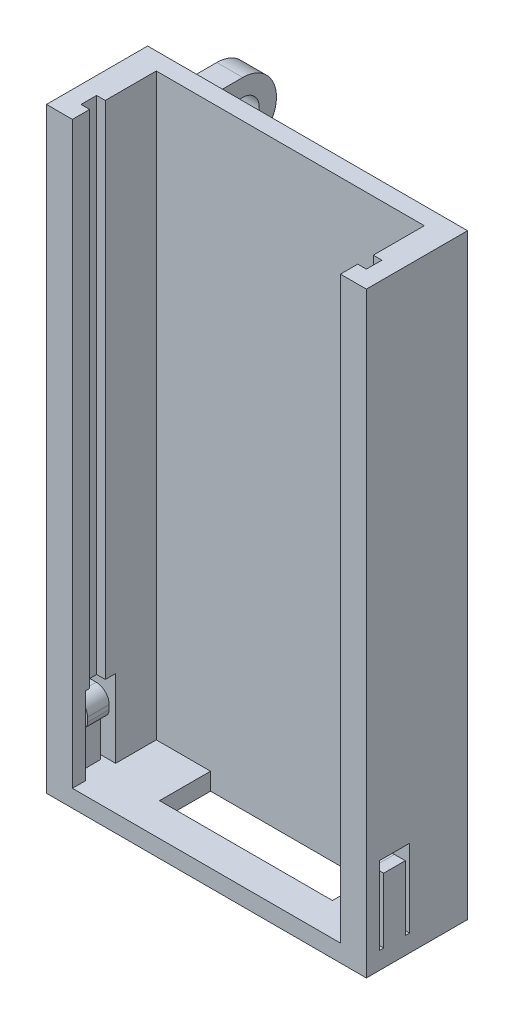
from build123d import *

# Parameters (mm, degrees)
SKETCH1_W           = 37
SKETCH1_H           = 11.7
BOSS_EXTRUDE1_DEPTH = 69
CUT_EXTRUDE1_DEPTH  = 67
SKETCH3_W           = 20
SKETCH3_H           = 5.9
CUT_EXTRUDE2_DEPTH  = 67
BOSS_EXTRUDE2_START = -34
SKETCH4_R           = 1.9
BOSS_EXTRUDE2_DEPTH = 3
FILLET1_R           = 2
SKETCH5_W           = 3.5
SKETCH5_H           = 9
CUT_EXTRUDE3_DEPTH  = 40
BOSS_EXTRUDE3_START = 0.5
BOSS_EXTRUDE3_DEPTH = 2.5


with BuildPart() as part:
    # Sketch1 → Boss-Extrude1 (new body)
    with BuildSketch(Plane(origin=(0, 0, 0), x_dir=(1, 0, 0), z_dir=(0, 1, 0))):
        with Locations((18.5, 5.85)):
            Rectangle(SKETCH1_W, SKETCH1_H)
    extrude(amount=BOSS_EXTRUDE1_DEPTH)

    # Sketch2 → Cut-Extrude1 (cut)
    with BuildSketch(Plane(origin=(0, 69, 0), x_dir=(1, 0, 0), z_dir=(0, 1, 0))):
        Polygon((3, 0), (3, 2), (2, 2), (2, 3.8), (3, 3.8), (3, 9.7), (34, 9.7), (34, 3.8), (35, 3.8), (35, 2), (34, 2), (34, 0), align=None)
    extrude(amount=-CUT_EXTRUDE1_DEPTH, mode=Mode.SUBTRACT)

    # Sketch3 → Cut-Extrude2 (cut)
    with BuildSketch(Plane(origin=(0, 2, 0), x_dir=(1, 0, 0), z_dir=(0, 1, 0))):
        with Locations((19.275, 6.75)):
            Rectangle(SKETCH3_W, SKETCH3_H)
    extrude(amount=-CUT_EXTRUDE2_DEPTH, mode=Mode.SUBTRACT)

    # Sketch4 → Boss-Extrude2 (add)
    # profile 1 of 2: a face of its own
    with BuildSketch(Plane(origin=(37, 0, 0), x_dir=(0, 0, -1), z_dir=(1, 0, 0)).offset(BOSS_EXTRUDE2_START)):
        with BuildLine():
            Line((11.7, 63.35), (19.7, 63.35))
            ThreePointArc((19.7, 63.35), (23.6, 59.45), (19.7, 55.55))
            Line((19.7, 55.55), (11.7, 55.55))
            Line((11.7, 55.55), (11.7, 63.35))
        make_face()
        with Locations((19.7, 59.45)):
            Circle(SKETCH4_R, mode=Mode.SUBTRACT)
    # profile 2 of 2: a face of its own
    with BuildSketch(Plane(origin=(37, 0, 0), x_dir=(0, 0, -1), z_dir=(1, 0, 0)).offset(BOSS_EXTRUDE2_START)):
        with BuildLine():
            Line((11.7, 27.35), (19.7, 27.35))
            ThreePointArc((19.7, 27.35), (23.6, 23.45), (19.7, 19.55))
            Line((19.7, 19.55), (11.7, 19.55))
            Line((11.7, 19.55), (11.7, 27.35))
        make_face()
        with Locations((19.7, 23.45)):
            Circle(SKETCH4_R, mode=Mode.SUBTRACT)
    extrude(amount=-BOSS_EXTRUDE2_DEPTH)

    # Fillet1
    fillet1_edges = [part.edges().sort_by_distance(p)[0] for p in [
        (1.5, 55.55, -11.7),
        (1.5, 63.35, -11.7),
        (3, 59.45, -11.7),
        (1.5, 19.55, -11.7),
        (1.5, 27.35, -11.7),
        (3, 23.45, -11.7),
    ]]
    fillet(fillet1_edges, radius=FILLET1_R)

    # Sketch5 → Cut-Extrude3 (cut)
    with BuildSketch(Plane(origin=(37, 0, 0), x_dir=(0, 0, -1), z_dir=(1, 0, 0))):
        with Locations((3.25, 6.5)):
            Rectangle(SKETCH5_W, SKETCH5_H)
    extrude(amount=-CUT_EXTRUDE3_DEPTH, mode=Mode.SUBTRACT)

    # Sketch6 → Boss-Extrude3 (add)
    with BuildSketch(Plane.XY.offset(-5).offset(BOSS_EXTRUDE3_START)):
        with BuildLine():
            Line((37, 2), (37, 9.5))
            Line((37, 9.5), (35.75, 9.5))
            ThreePointArc((35.75, 9.5), (34.689339828, 9.060660172), (34.25, 8))
            Line((34.25, 8), (34.25, 7.5))
            ThreePointArc((34.25, 7.5), (34.542893219, 6.792893219), (35.25, 6.5))
            Line((35.25, 6.5), (35.25, 2))
            Line((35.25, 2), (37, 2))
        make_face()
    boss_extrude3 = extrude(amount=BOSS_EXTRUDE3_DEPTH)

    # Mirror1: Boss-Extrude3 across plane
    add(boss_extrude3.mirror(Plane(origin=(18.5, 0, 0), x_dir=(0, 0, 1), z_dir=(1, 0, 0))))


solid = part.part
